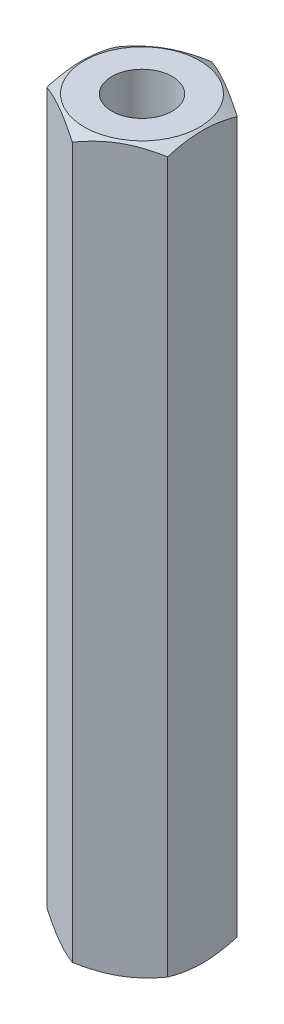
from build123d import *

# Parameters (mm, degrees)
EXTRUDE_1_DEPTH   = 30
HOLE_WIZARD_M31_D = 2.5


with BuildPart() as part:
    # Эскиз1 → Бобышка-Вытянуть1 (new body)
    with BuildSketch(Plane(origin=(0, 0, 0), x_dir=(1, 0, 0), z_dir=(0, 1, 0))):
        Polygon((0, 2.886751346), (-2.5, 1.443375673), (-2.5, -1.443375673), (0, -2.886751346), (2.5, -1.443375673), (2.5, 1.443375673), align=None)
    extrude(amount=EXTRUDE_1_DEPTH)

    # Отверстие обработанное метчиком M31 (through all)
    with Locations(Plane(origin=(0, 30, 0), x_dir=(1, 0, 0), z_dir=(0, 1, 0))):
        with Locations((0, 0)):
            Hole(HOLE_WIZARD_M31_D / 2)

    # Эскиз4 → Вырез-Повернуть1 (revolve, cut)
    with BuildSketch(Plane(origin=(0, 0, 0), x_dir=(0, 0, -1), z_dir=(1, 0, 0)), mode=Mode.PRIVATE) as cut_revolve_1_sk:
        Polygon((1.86348431, 30.302108364), (3.639820408, 29.27654024), (3.639820408, 31.381488227), (1.86348431, 31.381488227), align=None)
        Polygon((1.86348431, -0.302108364), (3.639820408, 0.72345976), (3.639820408, -1.381488227), (1.86348431, -1.381488227), align=None)
    revolve(cut_revolve_1_sk.sketch.rotate(Axis((0, 0, 0), (0, 1, 0)), 180), axis=Axis((0, 0, 0), (0, 1, 0)), mode=Mode.SUBTRACT)


solid = part.part
